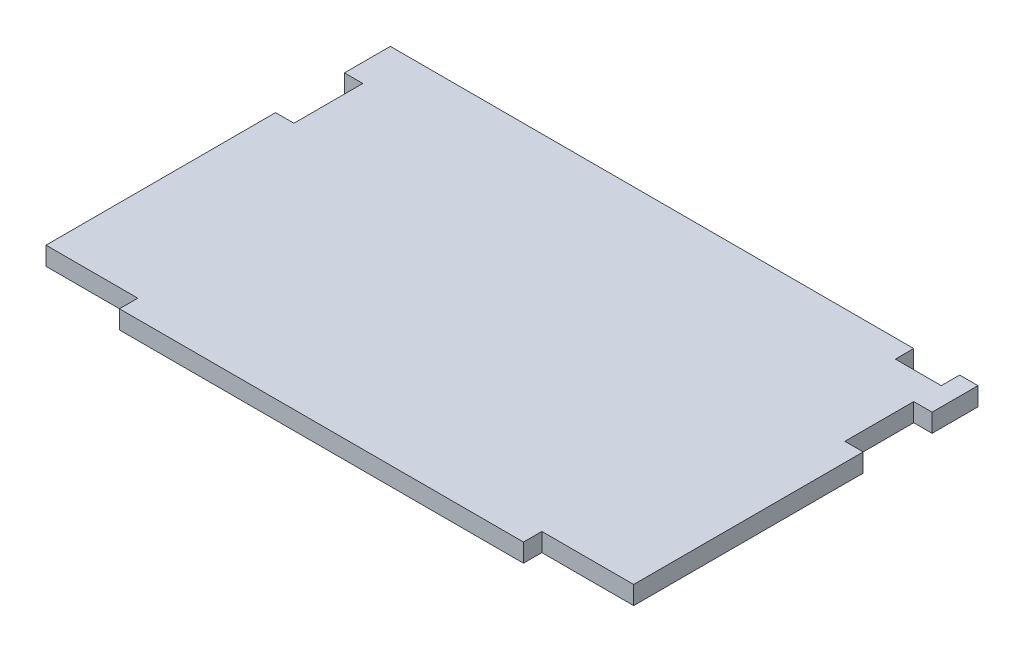
from build123d import *

# Parameters (mm, degrees)
BOSS_EXTRUDE1_DEPTH = 4


with BuildPart() as part:
    # Sketch1 → Boss-Extrude1 (new body)
    with BuildSketch(Plane(origin=(0, 0, 0), x_dir=(1, 0, 0), z_dir=(0, 1, 0))):
        Polygon((0, 65), (4, 65), (4, 50), (0, 50), (0, 0), (20, 0), (20, -4), (108, -4), (108, 0), (128, 0), (128, 50), (124, 50), (124, 65), (128, 65), (128, 75), (124, 75), (124, 71), (114, 71), (114, 75), (0, 75), align=None)
    extrude(amount=BOSS_EXTRUDE1_DEPTH)


solid = part.part
